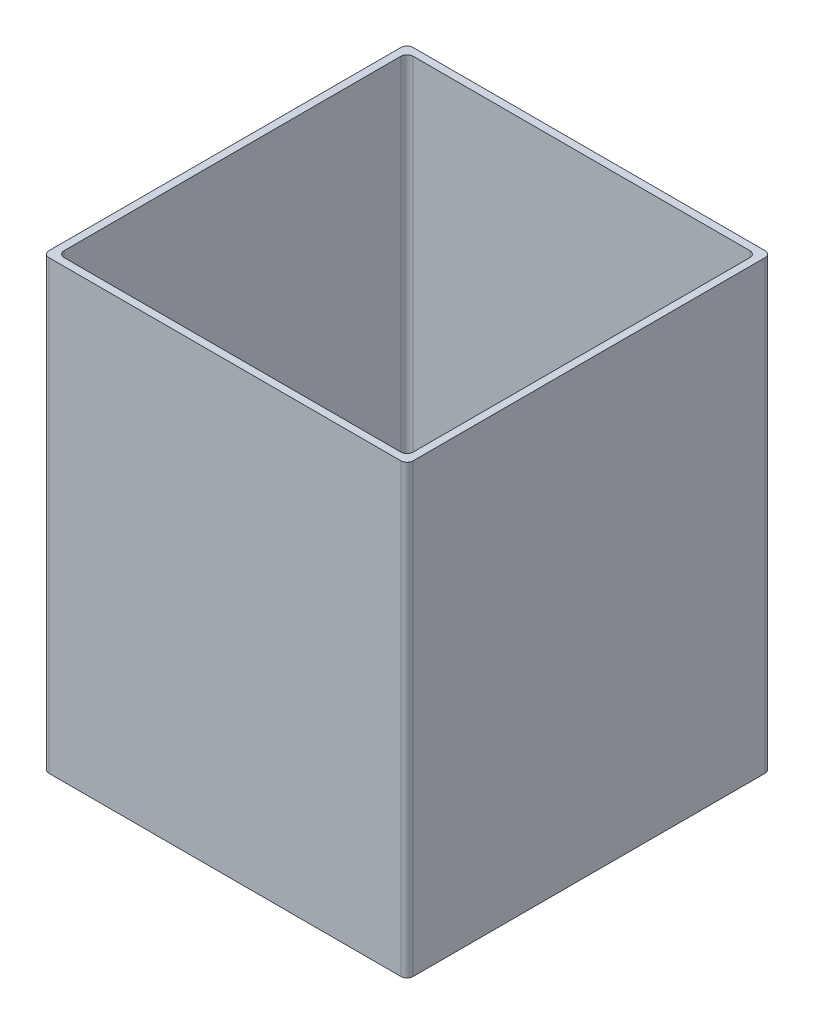
from build123d import *

# Parameters (mm, degrees)
ESBO_O2_W                  = 120
ESBO_O2_H                  = 120
RESSALTO_EXTRUS_O1_DEPTH   = 147.2
CORTE_EXTRUS_O1_DEPTH      = 170.905385436
CORTE_EXTRUS_O1_DEPTH_BACK = 170.905385436
ESBO_O3_W                  = 115
ESBO_O3_H                  = 115
FILETE1_R                  = 2
FILETE2_R                  = 2


with BuildPart() as part:
    # Esboço2 → Ressalto-extrusão1 (new body)
    with BuildSketch(Plane(origin=(0, 0, 0), x_dir=(1, 0, 0), z_dir=(0, 1, 0))):
        Rectangle(ESBO_O2_W, ESBO_O2_H)
    extrude(amount=RESSALTO_EXTRUS_O1_DEPTH)

    # Esboço3 → Corte-extrusão1 (cut, two sides: drawn at the far end of the back side and taken through both)
    with BuildSketch(Plane(origin=(0, 147.2, 0), x_dir=(1, 0, 0), z_dir=(0, 1, 0)).offset(-CORTE_EXTRUS_O1_DEPTH_BACK)):
        Rectangle(ESBO_O3_W, ESBO_O3_H)
    extrude(amount=CORTE_EXTRUS_O1_DEPTH + CORTE_EXTRUS_O1_DEPTH_BACK, mode=Mode.SUBTRACT)

    # Filete1
    filete1_edges = [part.edges().sort_by_distance(p)[0] for p in [
        (60, 73.6, 60),
        (-60, 73.6, 60),
        (-60, 73.6, -60),
        (60, 73.6, -60),
    ]]
    fillet(filete1_edges, radius=FILETE1_R)

    # Filete2
    filete2_edges = [part.edges().sort_by_distance(p)[0] for p in [
        (57.5, 73.6, -57.5),
        (57.5, 73.6, 57.5),
        (-57.5, 73.6, 57.5),
        (-57.5, 73.6, -57.5),
    ]]
    fillet(filete2_edges, radius=FILETE2_R)


solid = part.part
